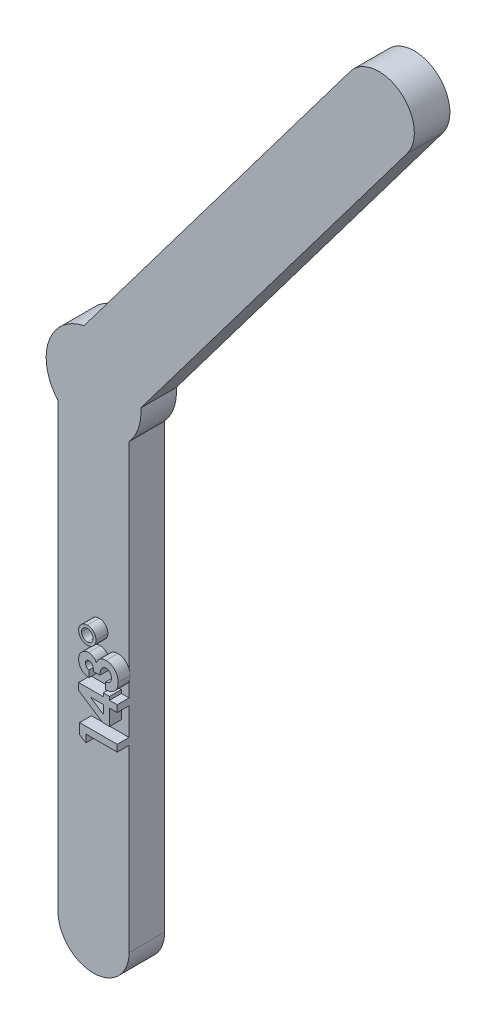
from build123d import *

# Parameters (mm, degrees)
BOSS_EXTRUDE1_DEPTH = 3
BOSS_EXTRUDE2_DEPTH = 1


with BuildPart() as part:
    # Sketch2 → Boss-Extrude1 (new body)
    with BuildSketch(Plane.XY):
        with BuildLine():
            Line((-3, -40), (-3, -2.645751311))
            ThreePointArc((-3, -2.645751311), (-3.793294621, 1.269218626), (-0.803653644, 3.918436017))
            Line((-0.803653644, 3.918436017), (21.676694396, 33.750865471))
            ThreePointArc((21.676694396, 33.750865471), (25.878045996, 34.341326932), (26.468507456, 30.139975332))
            Line((26.468507456, 30.139975332), (3.988159417, 0.307545878))
            ThreePointArc((3.988159417, 0.307545878), (3.793294621, -1.269218626), (3, -2.645751311))
            Line((3, -2.645751311), (3, -40))
            ThreePointArc((3, -40), (0, -43), (-3, -40))
        make_face()
    extrude(amount=BOSS_EXTRUDE1_DEPTH)

    # Sketch3 → Boss-Extrude2 (add)
    # profile 1 of 4: a face of its own
    with BuildSketch(Plane.XY.offset(3)):
        Polygon((-0.175, -25.154881865), (-0.175, -24.27399745), (3, -24.27399745), (3, -24.843869245), (0.354166667, -24.843869245), (0.354166667, -25.495151297), align=None)
    # profile 2 of 4: a face of its own
    with BuildSketch(Plane.XY.offset(3)):
        Polygon((-0.256410256, -21.977973813), (-0.256410256, -21.383933348), (1.819551282, -21.383933348), (1.819551282, -21.09899745), (2.348717949, -21.09899745), (2.348717949, -21.383933348), (3, -21.383933348), (3, -21.953805143), (2.348717949, -21.953805143), (2.348717949, -23.297074373), (1.77184996, -23.297074373), align=None)
        Polygon((1.819551282, -21.953805143), (0.738957332, -21.953805143), (1.819551282, -22.656604622), align=None, mode=Mode.SUBTRACT)
    # profile 3 of 4: a face of its own
    with BuildSketch(Plane.XY.offset(3)):
        with BuildLine():
            Line((0.598397436, -20.040664117), (0.598397436, -20.610535912))
            add(Edge.make_bspline(
                [(0.598397436, -20.610535912), (0.569905344, -20.6065375), (0.514253238, -20.598727612), (0.433490113, -20.57952876), (0.35669034, -20.557326452), (0.284266078, -20.52893284), (0.216295401, -20.496157537), (0.152717485, -20.457937086), (0.092619933, -20.41604494), (0.05660533, -20.383246008), (0.038701923, -20.36694116)],
                knots=[0, 0, 0, 0, 1.1115466, 2.171125598, 3.205689823, 4.19946166, 5.17440286, 6.118867946, 7.064860634, 8, 8, 8, 8], degree=3))
            add(Edge.make_bspline(
                [(0.038701923, -20.36694116), (0.015043155, -20.343481578), (-0.031585791, -20.297245207), (-0.09131232, -20.219978808), (-0.14300157, -20.138989352), (-0.18398118, -20.052652561), (-0.217149428, -19.9623119), (-0.239428614, -19.867248948), (-0.254211051, -19.767852168), (-0.255667173, -19.70002637), (-0.256410256, -19.665413716)],
                knots=[0, 0, 0, 0, 1.01925491, 2.00884431, 2.983262333, 3.955970413, 4.92937149, 5.924503185, 6.940838805, 8, 8, 8, 8], degree=3))
            add(Edge.make_bspline(
                [(-0.256410256, -19.665413716), (-0.25568378, -19.634641286), (-0.254255673, -19.574148889), (-0.242791605, -19.485240286), (-0.222684907, -19.400473373), (-0.19639585, -19.31895214), (-0.160625195, -19.241875498), (-0.119103078, -19.167542291), (-0.068174475, -19.098029392), (-0.01063028, -19.033174153), (0.0516094, -18.973592246), (0.1181385, -18.921994054), (0.187179874, -18.877634163), (0.259307125, -18.841087479), (0.3346423, -18.812988046), (0.4127502, -18.793486207), (0.493458473, -18.780721779), (0.548314798, -18.779450108), (0.576136819, -18.778805143)],
                knots=[0, 0, 0, 0, 1.091422571, 2.145516843, 3.172569842, 4.178562979, 5.178154469, 6.181868002, 7.194278174, 8.227918432, 9.254613415, 10.245994977, 11.209837596, 12.161663635, 13.10878368, 14.055455738, 15.013766427, 16, 16, 16, 16], degree=3))
            add(Edge.make_bspline(
                [(0.576136819, -18.778805143), (0.610585958, -18.780154134), (0.678613472, -18.782818018), (0.777980899, -18.803885435), (0.8727781, -18.837752509), (0.961881861, -18.885906469), (1.045199363, -18.946377323), (1.1198207, -19.020533365), (1.186901514, -19.106305195), (1.222951204, -19.170693461), (1.241411258, -19.203664918)],
                knots=[0, 0, 0, 0, 0.992776698, 1.96045919, 2.915875678, 3.886951799, 4.871409521, 5.874469288, 6.911574252, 8, 8, 8, 8], degree=3))
            add(Edge.make_bspline(
                [(1.241411258, -19.203664918), (1.248840578, -19.181032969), (1.26343886, -19.136562205), (1.292207769, -19.073365106), (1.323580612, -19.013222423), (1.360205051, -18.957509599), (1.399542556, -18.904698842), (1.44370819, -18.856461012), (1.491568291, -18.811547008), (1.543631999, -18.771067945), (1.599033683, -18.734877786), (1.656777581, -18.702983753), (1.717074737, -18.676218665), (1.779482048, -18.65375486), (1.844613707, -18.636615599), (1.912248991, -18.624557508), (1.982224933, -18.617585365), (2.02963392, -18.616522205), (2.053605769, -18.61598463)],
                knots=[0, 0, 0, 0, 1.059375415, 2.081625174, 3.086260357, 4.075579879, 5.045586876, 6.014170127, 6.982201689, 7.963705737, 8.945119069, 9.924852636, 10.896327119, 11.878239286, 12.873838556, 13.889973282, 14.933087432, 16, 16, 16, 16], degree=3))
            add(Edge.make_bspline(
                [(2.053605769, -18.61598463), (2.088834625, -18.617074457), (2.158298755, -18.619223375), (2.260612118, -18.632885524), (2.358159557, -18.658320994), (2.452060019, -18.691786039), (2.541114181, -18.736412521), (2.627316675, -18.78897542), (2.707744153, -18.853314042), (2.783940091, -18.925463773), (2.853551958, -19.005171918), (2.915054815, -19.090943053), (2.965754166, -19.182943356), (3.00908881, -19.278948612), (3.04124993, -19.381121611), (3.064801955, -19.48814067), (3.079131724, -19.600787283), (3.080639979, -19.677667745), (3.081410256, -19.716931144)],
                knots=[0, 0, 0, 0, 1.005228408, 1.982105694, 2.937129188, 3.876607107, 4.82066901, 5.774063015, 6.75178259, 7.752926466, 8.764612432, 9.766578198, 10.757677051, 11.756882247, 12.76686714, 13.807379907, 14.880213281, 16, 16, 16, 16], degree=3))
            add(Edge.make_bspline(
                [(3.081410256, -19.716931144), (3.080599988, -19.754074478), (3.079015615, -19.826703352), (3.065302063, -19.93293828), (3.043180991, -20.033904524), (3.011999506, -20.12985975), (2.971562448, -20.220432716), (2.923410986, -20.306444772), (2.864767854, -20.386179568), (2.798280315, -20.460525505), (2.723685071, -20.527833366), (2.642710085, -20.587990743), (2.555047441, -20.639671156), (2.46107167, -20.683086546), (2.360617912, -20.717897503), (2.253890444, -20.745356284), (2.140680753, -20.764536692), (2.062790077, -20.770378125), (2.023076923, -20.773356425)],
                knots=[0, 0, 0, 0, 1.066544725, 2.085487077, 3.070979577, 4.031932826, 4.977951092, 5.916076795, 6.857635327, 7.814973522, 8.776389752, 9.738577119, 10.707772778, 11.69409279, 12.707140348, 13.757286496, 14.856535458, 16, 16, 16, 16], degree=3))
            Line((2.023076923, -20.773356425), (2.023076923, -20.20348463))
            add(Edge.make_bspline(
                [(2.023076923, -20.20348463), (2.043044885, -20.199872708), (2.081937728, -20.192837541), (2.138251456, -20.179128289), (2.190212049, -20.161216234), (2.23820125, -20.14073744), (2.282711557, -20.11809573), (2.322552685, -20.091042811), (2.359290392, -20.06203608), (2.401517912, -20.018432355), (2.445802396, -19.957595168), (2.485022762, -19.875225195), (2.507328862, -19.783178402), (2.510104057, -19.718959072), (2.511538462, -19.685766281)],
                knots=[0, 0, 0, 0, 0.928450228, 1.808400301, 2.64896863, 3.43999153, 4.194978884, 4.9294959, 5.640047715, 6.332896648, 7.70085756, 9.063442004, 10.482192841, 12, 12, 12, 12], degree=3))
            add(Edge.make_bspline(
                [(2.511538462, -19.685766281), (2.511234698, -19.668150574), (2.510639692, -19.633645346), (2.504104723, -19.582949367), (2.493216621, -19.534703782), (2.478821118, -19.48850793), (2.4592865, -19.445087794), (2.436616641, -19.403460265), (2.4088653, -19.364386621), (2.377245282, -19.328094482), (2.343480924, -19.294318614), (2.306533866, -19.265477934), (2.268178179, -19.240578335), (2.227399343, -19.220930875), (2.185484675, -19.204487167), (2.141101944, -19.194231482), (2.095214543, -19.18653442), (2.063816677, -19.186084678), (2.047881611, -19.185856425)],
                knots=[0, 0, 0, 0, 1.110702965, 2.175618623, 3.217100552, 4.227908035, 5.221854906, 6.215531843, 7.213608581, 8.237687243, 9.249555755, 10.220750668, 11.188994735, 12.127982202, 13.071814005, 14.022160605, 14.996205625, 16, 16, 16, 16], degree=3))
            add(Edge.make_bspline(
                [(2.047881611, -19.185856425), (2.030448232, -19.186436866), (1.995950897, -19.187585449), (1.945396706, -19.197692925), (1.896579334, -19.212822325), (1.849901563, -19.23458121), (1.80563791, -19.26305368), (1.763421781, -19.297673283), (1.723589285, -19.338753198), (1.684980341, -19.384917769), (1.651182253, -19.438029654), (1.620059269, -19.495944113), (1.595277703, -19.560087916), (1.57314858, -19.628922244), (1.556984463, -19.703741346), (1.545248131, -19.784082878), (1.536512134, -19.869816579), (1.535258821, -19.928913962), (1.534615385, -19.959253861)],
                knots=[0, 0, 0, 0, 0.809868251, 1.602574917, 2.388262527, 3.182133002, 3.988875265, 4.829537611, 5.714850619, 6.646378958, 7.622533229, 8.636771727, 9.698525113, 10.814716514, 11.996253919, 13.252421425, 14.589425562, 16, 16, 16, 16], degree=3))
            Line((1.534615385, -19.959253861), (1.005448718, -19.959253861))
            add(Edge.make_bspline(
                [(1.005448718, -19.959253861), (1.0022437, -19.921474277), (0.996247747, -19.850796158), (0.982028627, -19.752758608), (0.963634458, -19.669942608), (0.939661871, -19.601401551), (0.911660162, -19.543547033), (0.879215485, -19.49371525), (0.841958845, -19.450238513), (0.799944528, -19.414477082), (0.755904956, -19.384675192), (0.709066574, -19.364274226), (0.661292945, -19.350600053), (0.628592786, -19.349314119), (0.612389824, -19.348676938)],
                knots=[0, 0, 0, 0, 1.700711886, 3.181695139, 4.441392523, 5.500267777, 6.431839453, 7.31822765, 8.161090383, 8.990537424, 9.787217293, 10.536619396, 11.274893404, 12, 12, 12, 12], degree=3))
            add(Edge.make_bspline(
                [(0.612389824, -19.348676938), (0.591714502, -19.349771701), (0.551360652, -19.351908447), (0.493502791, -19.368829048), (0.441654003, -19.397544009), (0.396394238, -19.436505634), (0.359475255, -19.484370414), (0.332017035, -19.539765179), (0.315998921, -19.602409235), (0.314326488, -19.646451846), (0.313461538, -19.669229822)],
                knots=[0, 0, 0, 0, 1.009324788, 1.969988301, 2.915956825, 3.885795408, 4.868116622, 5.850437836, 6.888288533, 8, 8, 8, 8], degree=3))
            add(Edge.make_bspline(
                [(0.313461538, -19.669229822), (0.314477881, -19.68987794), (0.316494615, -19.730850129), (0.331546985, -19.790763733), (0.356885777, -19.847661695), (0.391826478, -19.900365821), (0.433788778, -19.948115314), (0.483484413, -19.987303871), (0.537936031, -20.019899055), (0.578164626, -20.033715295), (0.598397436, -20.040664117)],
                knots=[0, 0, 0, 0, 0.98818071, 1.960853194, 2.938124878, 3.957524365, 4.978590984, 5.968022688, 6.978025184, 8, 8, 8, 8], degree=3))
        make_face()
    # profile 4 of 4: a face of its own
    with BuildSketch(Plane.XY.offset(3)):
        with BuildLine():
            add(Edge.make_bspline(
                [(0.476282051, -16.824958989), (0.501543872, -16.825505484), (0.55122174, -16.826580176), (0.624352745, -16.837013476), (0.694208258, -16.854492691), (0.761803607, -16.876903338), (0.825395964, -16.908042089), (0.886396731, -16.944903837), (0.943669883, -16.989402672), (0.9978957, -17.039014969), (1.047295391, -17.093515132), (1.090947065, -17.151405488), (1.127096601, -17.212864468), (1.157366856, -17.276577248), (1.180332148, -17.343408663), (1.196689885, -17.412864586), (1.20741609, -17.485236986), (1.208449037, -17.534503871), (1.208974359, -17.559559349)],
                knots=[0, 0, 0, 0, 1.048753193, 2.062393874, 3.059725798, 4.03711221, 5.013824111, 5.993903926, 6.992478922, 8.020738441, 9.043061753, 10.043343452, 11.026424807, 11.999358773, 12.968420071, 13.955122655, 14.960044262, 16, 16, 16, 16], degree=3))
            add(Edge.make_bspline(
                [(1.208974359, -17.559559349), (1.208454225, -17.584616682), (1.207431478, -17.633887214), (1.196631189, -17.706233128), (1.180530583, -17.775855144), (1.156529218, -17.842391691), (1.126678292, -17.90615653), (1.090260147, -17.967072817), (1.046482503, -18.024600993), (0.996781055, -18.078582797), (0.942375086, -18.128107638), (0.88420218, -18.171482912), (0.823225465, -18.208946116), (0.758107997, -18.237837437), (0.69067286, -18.261947038), (0.619758864, -18.27798784), (0.545943315, -18.288833106), (0.495615647, -18.289833085), (0.469921875, -18.290343604)],
                knots=[0, 0, 0, 0, 1.037227242, 2.039512271, 3.023626077, 3.993053151, 4.963434463, 5.936395473, 6.927031705, 7.952593414, 8.972234493, 9.969891786, 10.954906455, 11.929570282, 12.915563215, 13.916770353, 14.936449251, 16, 16, 16, 16], degree=3))
            add(Edge.make_bspline(
                [(0.469921875, -18.290343604), (0.445290866, -18.289811451), (0.396869022, -18.288765297), (0.325492116, -18.278103661), (0.256787066, -18.261182775), (0.190979117, -18.23681523), (0.128167681, -18.205730248), (0.067236284, -18.169180135), (0.010175979, -18.123937412), (-0.044275745, -18.073515722), (-0.093962638, -18.018218509), (-0.137555056, -17.95952238), (-0.173973759, -17.89802202), (-0.203993097, -17.834134423), (-0.227847104, -17.767768562), (-0.244158222, -17.698411219), (-0.254789074, -17.626671533), (-0.255866772, -17.577830012), (-0.256410256, -17.553199173)],
                knots=[0, 0, 0, 0, 1.027628768, 2.020204677, 3.0054932, 3.977172113, 4.942988595, 5.928118098, 6.937247537, 7.976812879, 9.023474825, 10.036014018, 11.024160528, 12.002107364, 12.979092523, 13.962271943, 14.972371232, 16, 16, 16, 16], degree=3))
            add(Edge.make_bspline(
                [(-0.256410256, -17.553199173), (-0.255881051, -17.528566172), (-0.254836181, -17.479930408), (-0.244068832, -17.408427146), (-0.227959354, -17.339440503), (-0.203981879, -17.27352423), (-0.173948227, -17.210285117), (-0.137706982, -17.149501332), (-0.093944483, -17.091941849), (-0.043999627, -17.038019265), (0.009956511, -16.987787182), (0.068273488, -16.944627592), (0.128824771, -16.907104674), (0.192846684, -16.877455064), (0.259342082, -16.853394895), (0.329176204, -16.837233977), (0.401748506, -16.826543556), (0.451226198, -16.825491671), (0.476282051, -16.824958989)],
                knots=[0, 0, 0, 0, 1.02774298, 2.029191086, 3.012479778, 3.981238486, 4.951290381, 5.931946007, 6.930416638, 7.964088953, 8.997761269, 10.003308488, 10.98854748, 11.966603007, 12.943696749, 13.935593372, 14.954569896, 16, 16, 16, 16], degree=3))
        make_face()
        with BuildLine():
            add(Edge.make_bspline(
                [(0.479462139, -17.069189758), (0.462471258, -17.069424264), (0.428972226, -17.069886612), (0.379883793, -17.077505977), (0.332524379, -17.088023775), (0.287283463, -17.10328392), (0.24427911, -17.123234284), (0.203398935, -17.147571829), (0.164484674, -17.176174899), (0.128492582, -17.209237523), (0.095853701, -17.245103846), (0.066652511, -17.282897251), (0.042455186, -17.323086522), (0.023016589, -17.365273093), (0.006315159, -17.408801858), (-0.003707976, -17.454711924), (-0.01154919, -17.502263298), (-0.011966436, -17.534718897), (-0.012179487, -17.55129112)],
                knots=[0, 0, 0, 0, 1.061159961, 2.092171217, 3.098605391, 4.092036902, 5.070589041, 6.057187883, 7.061962211, 8.084674938, 9.107387665, 10.090954379, 11.06617917, 12.032717429, 12.99305519, 13.973669989, 14.965331307, 16, 16, 16, 16], degree=3))
            add(Edge.make_bspline(
                [(-0.012179487, -17.55129112), (-0.01157068, -17.568051412), (-0.01036426, -17.601263796), (-0.004409395, -17.650200831), (0.007572839, -17.69685371), (0.022606002, -17.742054962), (0.043122897, -17.784898142), (0.067542797, -17.826391236), (0.096744971, -17.865435361), (0.129769422, -17.902214665), (0.165718261, -17.935960463), (0.204573602, -17.964950546), (0.244977971, -17.990352408), (0.287582445, -18.010455361), (0.331832846, -18.026567734), (0.377821945, -18.038209426), (0.425871214, -18.044356322), (0.458458137, -18.045521173), (0.475010016, -18.046112835)],
                knots=[0, 0, 0, 0, 1.042034071, 2.064906527, 3.055369705, 4.030203466, 5.020228521, 6.000742353, 7.017744738, 8.043920206, 9.069249762, 10.075703201, 11.051782302, 12.029903876, 12.99669358, 13.974371501, 14.971122288, 16, 16, 16, 16], degree=3))
            add(Edge.make_bspline(
                [(0.475010016, -18.046112835), (0.491349767, -18.045520146), (0.523514051, -18.044353455), (0.570936909, -18.038223162), (0.616468237, -18.026465839), (0.660506807, -18.010425399), (0.703332854, -17.990458383), (0.743356347, -17.964229259), (0.782721478, -17.935019181), (0.819574977, -17.900938323), (0.853594861, -17.864058718), (0.883277913, -17.824563201), (0.908722399, -17.783622403), (0.929101491, -17.740636346), (0.945194342, -17.696373754), (0.956841315, -17.650387952), (0.962986781, -17.60233779), (0.964151827, -17.56975099), (0.96474359, -17.553199173)],
                knots=[0, 0, 0, 0, 1.017878107, 2.003660885, 2.970612419, 3.939454555, 4.919652619, 5.904816436, 6.913406512, 7.969270601, 9.02513469, 10.033724766, 11.041277553, 12.021475617, 12.990317753, 13.970071221, 14.968938047, 16, 16, 16, 16], degree=3))
            add(Edge.make_bspline(
                [(0.96474359, -17.553199173), (0.964515736, -17.536840687), (0.964066668, -17.504600367), (0.956359019, -17.457448889), (0.946146284, -17.411789288), (0.929505189, -17.368485652), (0.910263551, -17.326033898), (0.884925795, -17.286252494), (0.856415485, -17.247396305), (0.822504018, -17.212069657), (0.787116244, -17.177952839), (0.747777121, -17.149765554), (0.707718654, -17.124520148), (0.665616684, -17.10387006), (0.621397497, -17.089062601), (0.575848465, -17.07693948), (0.528165265, -17.071009446), (0.49579822, -17.069800121), (0.479462139, -17.069189758)],
                knots=[0, 0, 0, 0, 1.029744634, 2.029484694, 3.00508751, 3.97324883, 4.947661161, 5.937798898, 6.940036528, 7.980134083, 9.020231638, 10.033191535, 11.023329272, 12.003497406, 12.979740652, 13.958541426, 14.969648588, 16, 16, 16, 16], degree=3))
        make_face(mode=Mode.SUBTRACT)
    extrude(amount=BOSS_EXTRUDE2_DEPTH)


solid = part.part
